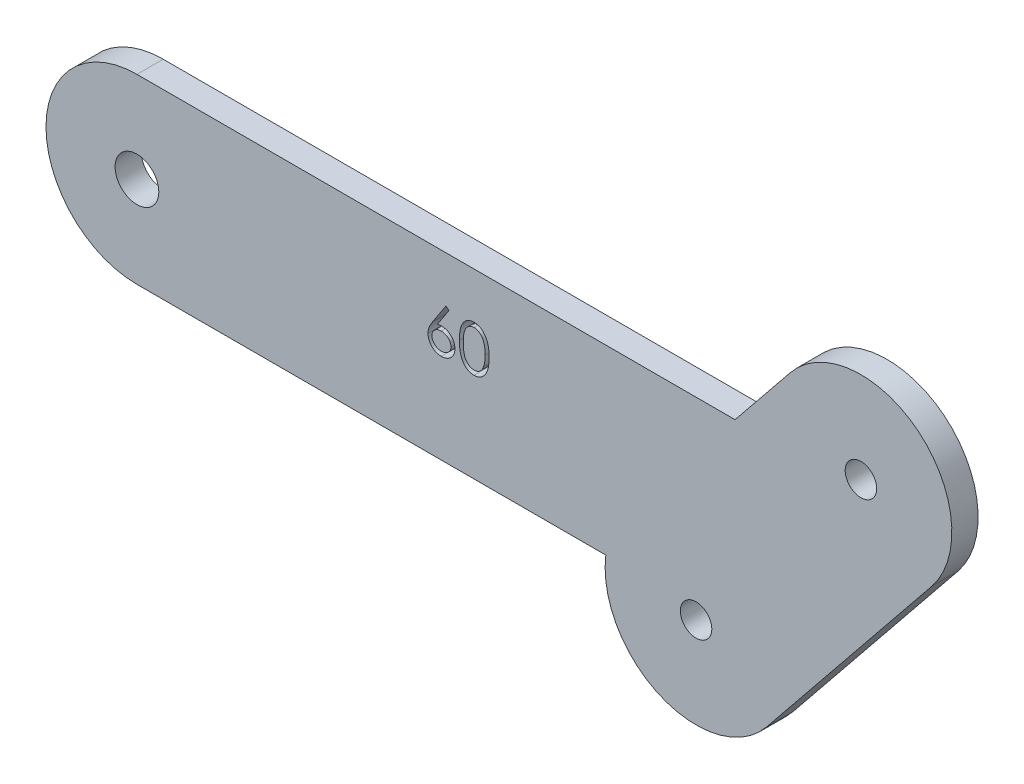
from build123d import *

# Parameters (mm, degrees)
SKETCH1_R            = 2.5
BOSS_EXTRUDE1_DEPTH  = 3
M3_CLEARANCE_HOLE1_D = 3.6
CUT_EXTRUDE1_DEPTH   = 2


with BuildPart() as part:
    # Sketch1 → Boss-Extrude1 (new body)
    with BuildSketch(Plane.XY):
        with BuildLine():
            ThreePointArc((53.62084913, -10.4), (59.884957147, -21.242518519), (72.032542278, -18.203533066))
            Line((72.032542278, -18.203533066), (90.887728901, 5.130603674))
            ThreePointArc((90.887728901, 5.130603674), (89.335026194, 19.756235773), (74.709394095, 18.203533066))
            Line((74.709394095, 18.203533066), (68.403736683, 10.4))
            Line((68.403736683, 10.4), (0, 10.4))
            ThreePointArc((0, 10.4), (-10.4, 0), (0, -10.4))
            Line((0, -10.4), (53.62084913, -10.4))
        make_face()
        Circle(SKETCH1_R, mode=Mode.SUBTRACT)
    extrude(amount=BOSS_EXTRUDE1_DEPTH)

    # M3 Clearance Hole1 (through all)
    with Locations(Plane.XY.offset(3)):
        with Locations((63.943374874, -11.66706837), (82.798561498, 11.66706837)):
            Hole(M3_CLEARANCE_HOLE1_D / 2)

    # Sketch5 → Cut-Extrude1 (cut)
    # profile 1 of 2: a face of its own
    with BuildSketch(Plane.XY.offset(3)):
        with BuildLine():
            Line((35.339330247, 5.128205128), (35.684883132, 4.856770833))
            Line((35.684883132, 4.856770833), (34.36376935, 2.836538462))
            add(Edge.make_bspline(
                [(34.36376935, 2.836538462), (34.451726888, 2.850558262), (34.623298012, 2.877905469), (34.796963581, 2.88241682), (34.881597875, 2.884615385)],
                knots=[0, 0, 0, 0, 1.025318673, 2, 2, 2, 2], degree=3))
            add(Edge.make_bspline(
                [(34.881597875, 2.884615385), (34.932415727, 2.883249511), (35.032449156, 2.880560829), (35.179316017, 2.859869613), (35.320443068, 2.827262311), (35.455245371, 2.779730517), (35.584206774, 2.719012867), (35.70806734, 2.646243053), (35.824498783, 2.557663509), (35.935000467, 2.458713573), (36.035324892, 2.34911788), (36.124147829, 2.232830257), (36.198757531, 2.109971855), (36.259291705, 1.980604904), (36.306298674, 1.844928819), (36.340566739, 1.703117191), (36.3608233, 1.555072232), (36.363574001, 1.454389124), (36.364971273, 1.403245192)],
                knots=[0, 0, 0, 0, 1.04369286, 2.054478336, 3.041073146, 4.015093852, 4.984733326, 5.965804835, 6.960378782, 7.985147595, 9.009457201, 10.008161701, 10.986880575, 11.956520048, 12.937015923, 13.931873656, 14.949455224, 16, 16, 16, 16], degree=3))
            add(Edge.make_bspline(
                [(36.364971273, 1.403245192), (36.362938266, 1.333274187), (36.358937789, 1.195587807), (36.319075223, 0.995049655), (36.257132874, 0.804003204), (36.168593547, 0.625498673), (36.058618714, 0.459780717), (35.924507868, 0.312944338), (35.77101717, 0.181987142), (35.597464601, 0.072477686), (35.410688938, -0.016955244), (35.214471799, -0.081191305), (35.010718733, -0.120739118), (34.872426436, -0.125697122), (34.802471273, -0.128205128)],
                knots=[0, 0, 0, 0, 1.031375318, 2.029502543, 3.004789286, 3.987476834, 4.960371455, 5.9300674, 6.912260825, 7.929083631, 8.949397511, 9.960523116, 10.96833055, 12, 12, 12, 12], degree=3))
            add(Edge.make_bspline(
                [(34.802471273, -0.128205128), (34.735190272, -0.126021977), (34.601918389, -0.121697537), (34.40587154, -0.083174769), (34.217495801, -0.02073605), (34.038110971, 0.065284347), (33.871938667, 0.173938466), (33.723273472, 0.304741722), (33.592856651, 0.454898101), (33.484321478, 0.624384311), (33.398237576, 0.806512822), (33.33368054, 0.996423045), (33.295971621, 1.193423019), (33.290702254, 1.326967503), (33.288048196, 1.394230769)],
                knots=[0, 0, 0, 0, 1.012016664, 2.004627821, 2.994792927, 3.992885782, 4.990978636, 5.973936114, 6.964471063, 7.975201453, 8.993600317, 9.990122807, 10.98767138, 12, 12, 12, 12], degree=3))
            add(Edge.make_bspline(
                [(33.288048196, 1.394230769), (33.289735974, 1.445723031), (33.293182096, 1.550860391), (33.317244082, 1.710094717), (33.355908074, 1.873024833), (33.399208426, 2.01124511), (33.444959298, 2.124475856), (33.483034354, 2.215766556), (33.530425777, 2.309710947), (33.580959179, 2.409530427), (33.639183277, 2.512652473), (33.702491348, 2.620800573), (33.772633706, 2.732254755), (33.821805367, 2.80788932), (33.846942426, 2.846554487)],
                knots=[0, 0, 0, 0, 1.173818275, 2.396712641, 3.66331629, 4.989737886, 5.693666774, 6.447286557, 7.243889047, 8.091586357, 8.998013824, 9.943181721, 10.948533338, 12, 12, 12, 12], degree=3))
            Line((33.846942426, 2.846554487), (35.339330247, 5.128205128))
        make_face()
        with BuildLine():
            add(Edge.make_bspline(
                [(34.787447234, 2.371794872), (34.749358313, 2.370683381), (34.674959585, 2.368512316), (34.565806136, 2.355904813), (34.462501491, 2.332163291), (34.363677014, 2.301925674), (34.271180296, 2.260349874), (34.184339096, 2.209847304), (34.102817593, 2.150388479), (34.027469662, 2.082815748), (33.959155857, 2.008832844), (33.900325671, 1.92959067), (33.849579385, 1.846998951), (33.808319643, 1.760367605), (33.776190964, 1.669729748), (33.752950605, 1.575502249), (33.740016675, 1.47705324), (33.737864916, 1.410292522), (33.736766144, 1.376201923)],
                knots=[0, 0, 0, 0, 1.129588631, 2.206414736, 3.251139165, 4.268635594, 5.265702196, 6.250456724, 7.242448911, 8.251968645, 9.246821453, 10.222880186, 11.173611482, 12.116736599, 13.062300278, 14.020270554, 14.989073742, 16, 16, 16, 16], degree=3))
            add(Edge.make_bspline(
                [(33.736766144, 1.376201923), (33.737660947, 1.342416238), (33.73941552, 1.276167538), (33.755347406, 1.178540139), (33.779683238, 1.084590269), (33.815883803, 0.994802271), (33.859065072, 0.907807531), (33.916072678, 0.826757123), (33.979239515, 0.746728452), (34.054745134, 0.673869207), (34.13577851, 0.606074029), (34.222351656, 0.546816524), (34.31258017, 0.496121991), (34.407682202, 0.456391851), (34.506308465, 0.423785727), (34.609280685, 0.400840757), (34.716670478, 0.387868577), (34.789416104, 0.385714015), (34.826509734, 0.384615385)],
                knots=[0, 0, 0, 0, 0.989467248, 1.94019797, 2.891935182, 3.827694429, 4.772920941, 5.730924762, 6.725747692, 7.756678648, 8.79901574, 9.819492441, 10.826891316, 11.826466727, 12.835195252, 13.867842842, 14.912794438, 16, 16, 16, 16], degree=3))
            add(Edge.make_bspline(
                [(34.826509734, 0.384615385), (34.863603303, 0.385714101), (34.93634881, 0.387868832), (35.043739467, 0.400839788), (35.146708494, 0.423789285), (35.245346364, 0.456378956), (35.340405551, 0.496169827), (35.430555153, 0.546501141), (35.516309572, 0.606438452), (35.597396143, 0.67375335), (35.672587484, 0.747143138), (35.737269311, 0.826042742), (35.792531072, 0.908462592), (35.837437054, 0.994459578), (35.873238899, 1.08464456), (35.897698137, 1.178525594), (35.913597122, 1.276171346), (35.915356216, 1.342417524), (35.916253324, 1.376201923)],
                knots=[0, 0, 0, 0, 1.087397944, 2.132534446, 3.165364764, 4.174271784, 5.174024072, 6.181601208, 7.194203697, 8.236725232, 9.267838612, 10.269026844, 11.221737037, 12.171628256, 13.107553087, 14.05945871, 15.010357665, 16, 16, 16, 16], degree=3))
            add(Edge.make_bspline(
                [(35.916253324, 1.376201923), (35.915467191, 1.410336996), (35.913924268, 1.477333042), (35.896472913, 1.575458211), (35.872269522, 1.670208506), (35.835722335, 1.760988433), (35.788241557, 1.847439758), (35.730408118, 1.929999187), (35.663504446, 2.009299684), (35.586222247, 2.082960838), (35.502093341, 2.150313807), (35.412642505, 2.209770316), (35.319059685, 2.259948854), (35.221439767, 2.301816143), (35.118664221, 2.332029678), (35.012392308, 2.355820025), (34.901264818, 2.36848005), (34.825869664, 2.370675858), (34.787447234, 2.371794872)],
                knots=[0, 0, 0, 0, 0.978206639, 1.919901502, 2.851605144, 3.780102724, 4.718870031, 5.675451981, 6.667674623, 7.690630536, 8.733308323, 9.756129687, 10.767539656, 11.776269907, 12.797430371, 13.836405707, 14.897401972, 16, 16, 16, 16], degree=3))
        make_face(mode=Mode.SUBTRACT)
    # profile 2 of 2: a face of its own
    with BuildSketch(Plane.XY.offset(3)):
        with BuildLine():
            add(Edge.make_bspline(
                [(36.877791785, 2.497996795), (36.878260383, 2.57813592), (36.87917064, 2.733807326), (36.889296956, 2.960642529), (36.906118873, 3.173442942), (36.929172263, 3.372218751), (36.95722652, 3.557021271), (36.994677216, 3.727356639), (37.037266934, 3.88401322), (37.08662757, 4.02750186), (37.142324412, 4.159755722), (37.202944784, 4.283220295), (37.270894491, 4.39770877), (37.342290081, 4.50504847), (37.420021611, 4.60348232), (37.501877026, 4.694400409), (37.591051135, 4.775701482), (37.684512576, 4.849767628), (37.783107525, 4.914695444), (37.884025619, 4.971885071), (37.987961485, 5.020742024), (38.095198889, 5.059156933), (38.204773972, 5.090886714), (38.317069781, 5.11258521), (38.43227173, 5.126237937), (38.510030922, 5.127543176), (38.549466465, 5.128205128)],
                knots=[0, 0, 0, 0, 1.646270934, 3.197905019, 4.663502075, 6.030701355, 7.308322542, 8.50163776, 9.611534131, 10.641858119, 11.616356847, 12.558055219, 13.465016945, 14.349605745, 15.204443733, 16.039544428, 16.859896111, 17.680448484, 18.487036065, 19.28249412, 20.06191084, 20.843045899, 21.620316918, 22.403196591, 23.190181807, 24, 24, 24, 24], degree=3))
            add(Edge.make_bspline(
                [(38.549466465, 5.128205128), (38.589231434, 5.127508249), (38.668311447, 5.126122377), (38.785226269, 5.112802459), (38.8994401, 5.090700854), (39.010466012, 5.059385176), (39.119215993, 5.02053421), (39.224839432, 4.971838328), (39.327992406, 4.915154232), (39.427035674, 4.848548693), (39.523056553, 4.774288298), (39.6136965, 4.690341629), (39.698963766, 4.597556315), (39.779928488, 4.496925081), (39.854293627, 4.386517817), (39.925112815, 4.268254803), (39.988501438, 4.140067853), (40.049550974, 4.004095757), (40.102246669, 3.856576244), (40.149769877, 3.698340872), (40.188168404, 3.527520605), (40.220153078, 3.345011683), (40.244931501, 3.15014385), (40.262978133, 2.943334828), (40.272511111, 2.724448555), (40.274306399, 2.574794485), (40.275227683, 2.497996795)],
                knots=[0, 0, 0, 0, 0.810914788, 1.612654377, 2.396697861, 3.181598691, 3.963628158, 4.749916497, 5.551656086, 6.361998678, 7.18212741, 8.025565596, 8.878627764, 9.750805457, 10.657531673, 11.591944965, 12.560506719, 13.57287815, 14.630710178, 15.753379473, 16.941251878, 18.199788006, 19.531962791, 20.947069417, 22.433333509, 24, 24, 24, 24], degree=3))
            add(Edge.make_bspline(
                [(40.275227683, 2.497996795), (40.274296848, 2.421534069), (40.272483154, 2.272549567), (40.263085001, 2.054648173), (40.244572671, 1.848936683), (40.221415545, 1.654921736), (40.18934274, 1.473410852), (40.149906789, 1.303775926), (40.106120613, 1.145284395), (40.052070907, 0.999234664), (39.99291275, 0.863589346), (39.928548184, 0.736921991), (39.859591289, 0.618113002), (39.784464511, 0.508113363), (39.704388206, 0.406143853), (39.617648508, 0.314004392), (39.526690529, 0.229474861), (39.430387078, 0.15425825), (39.329799148, 0.088422815), (39.227000466, 0.029545886), (39.120167062, -0.017929393), (39.011719986, -0.058693737), (38.900108035, -0.08983724), (38.785470334, -0.111371319), (38.668389997, -0.12647396), (38.589244904, -0.127626074), (38.549466465, -0.128205128)],
                knots=[0, 0, 0, 0, 1.561518951, 3.042555995, 4.452378317, 5.7783523, 7.031515105, 8.214008947, 9.334062868, 10.386615937, 11.391082383, 12.354592575, 13.286541444, 14.194233754, 15.072674879, 15.931287219, 16.775624067, 17.606195743, 18.42308326, 19.229000347, 20.022332153, 20.807536673, 21.593273796, 22.3848459, 23.188221202, 24, 24, 24, 24], degree=3))
            add(Edge.make_bspline(
                [(38.549466465, -0.128205128), (38.510032016, -0.127538906), (38.432274981, -0.126225246), (38.31705723, -0.112634201), (38.205225168, -0.090783482), (38.096226948, -0.060188334), (37.989503355, -0.022738567), (37.88650866, 0.026052409), (37.786097683, 0.082243936), (37.688538318, 0.146237395), (37.595663802, 0.219554086), (37.506951509, 0.300645927), (37.424630053, 0.391536514), (37.348009916, 0.49079069), (37.27518979, 0.597495322), (37.208204971, 0.713107283), (37.146246608, 0.837168155), (37.08961305, 0.970479456), (37.039400674, 1.114986496), (36.995046805, 1.272342466), (36.96002658, 1.443936231), (36.930050929, 1.628389613), (36.905873239, 1.826495228), (36.88936706, 2.038360625), (36.879165182, 2.263853781), (36.878257938, 2.418524887), (36.877791785, 2.497996795)],
                knots=[0, 0, 0, 0, 0.810891512, 1.598919785, 2.382837074, 3.152667961, 3.926044502, 4.706494248, 5.493654104, 6.291793342, 7.103789334, 7.925228297, 8.761435821, 9.622817696, 10.50288917, 11.416980706, 12.369136599, 13.353924996, 14.394355917, 15.514179734, 16.714354668, 17.994756427, 19.357759367, 20.818452758, 22.365282078, 24, 24, 24, 24], degree=3))
        make_face()
        with BuildLine():
            add(Edge.make_bspline(
                [(37.326509734, 2.5), (37.326680373, 2.433216145), (37.327011549, 2.303601795), (37.335663264, 2.115254279), (37.34744931, 1.939582381), (37.362651163, 1.776363043), (37.385226804, 1.626148739), (37.410522215, 1.487906335), (37.4413052, 1.362367425), (37.477726654, 1.248670552), (37.519211078, 1.144886169), (37.564505169, 1.048313004), (37.613163345, 0.957810238), (37.667619274, 0.874190798), (37.726926507, 0.797181992), (37.789745449, 0.725420803), (37.858420569, 0.661425115), (37.953425916, 0.584672465), (38.078849451, 0.505359417), (38.236878672, 0.436293574), (38.399262174, 0.392890065), (38.509478245, 0.387370414), (38.564490503, 0.384615385)],
                knots=[0, 0, 0, 0, 1.459021318, 2.831673884, 4.118529203, 5.306027144, 6.411944654, 7.436330062, 8.375795394, 9.233974572, 10.042671642, 10.816086306, 11.563610507, 12.285937304, 12.993564865, 13.685989202, 14.367179055, 15.041617293, 16.353048772, 17.594441528, 18.799311195, 20, 20, 20, 20], degree=3))
            add(Edge.make_bspline(
                [(38.564490503, 0.384615385), (38.619858606, 0.386897929), (38.730480496, 0.391458304), (38.892100203, 0.4354565), (39.049000589, 0.501841557), (39.171960504, 0.580337993), (39.265506995, 0.655092749), (39.332531266, 0.718827961), (39.394048478, 0.790193486), (39.452394299, 0.86719248), (39.505907265, 0.951296029), (39.55456889, 1.042099708), (39.598973672, 1.139855676), (39.624272309, 1.208098161), (39.63720685, 1.242988782)],
                knots=[0, 0, 0, 0, 1.353760809, 2.704726607, 4.075137775, 5.516104923, 6.260822281, 7.007110065, 7.778089737, 8.566572457, 9.372053459, 10.217411131, 11.088608312, 12, 12, 12, 12], degree=3))
            add(Edge.make_bspline(
                [(39.63720685, 1.242988782), (39.652280804, 1.287602696), (39.682887395, 1.378188073), (39.722332787, 1.518707576), (39.753397643, 1.666140096), (39.781345308, 1.819604548), (39.800421102, 1.980232693), (39.815775121, 2.147527527), (39.824818959, 2.321615187), (39.825940032, 2.439893746), (39.826509734, 2.5)],
                knots=[0, 0, 0, 0, 0.884706709, 1.796334032, 2.740027952, 3.714592787, 4.726048262, 5.777819803, 6.87074269, 8, 8, 8, 8], degree=3))
            add(Edge.make_bspline(
                [(39.826509734, 2.5), (39.82572375, 2.560096532), (39.824186196, 2.677658196), (39.81830907, 2.849827026), (39.803132535, 3.013352398), (39.786276651, 3.168938788), (39.761423478, 3.315724935), (39.734626611, 3.454939656), (39.698624879, 3.584858263), (39.660168058, 3.707514809), (39.616153207, 3.821515744), (39.567702158, 3.927392581), (39.515956789, 4.025656474), (39.459753588, 4.116037819), (39.399759755, 4.198941452), (39.334391828, 4.272705158), (39.266242724, 4.339615113), (39.170789601, 4.415990211), (39.04582633, 4.493864062), (38.890332548, 4.565529433), (38.728517342, 4.606684137), (38.619126693, 4.612486547), (38.564490503, 4.615384615)],
                knots=[0, 0, 0, 0, 1.31362396, 2.569729283, 3.763502607, 4.902122613, 5.988968491, 7.01645872, 7.998833611, 8.933434873, 9.825090667, 10.667526885, 11.477055099, 12.250526234, 12.991942729, 13.710640831, 14.402115721, 15.076753259, 16.378508321, 17.609869233, 18.806226677, 20, 20, 20, 20], degree=3))
            add(Edge.make_bspline(
                [(38.564490503, 4.615384615), (38.509189658, 4.612482549), (38.398487221, 4.606673129), (38.234990143, 4.565682766), (38.07826964, 4.494235672), (37.953636819, 4.415732283), (37.858117124, 4.340963267), (37.790856134, 4.276125475), (37.727790174, 4.205202255), (37.669693459, 4.127485233), (37.615280197, 4.04396328), (37.565307322, 3.95397933), (37.520282566, 3.857077381), (37.478733228, 3.753339617), (37.442200674, 3.639652553), (37.412066441, 3.514268277), (37.384227793, 3.376465574), (37.364520266, 3.225437706), (37.347000615, 3.062177486), (37.335741547, 2.886067032), (37.326982608, 2.697403631), (37.326670516, 2.567119119), (37.326509734, 2.5)],
                knots=[0, 0, 0, 0, 1.207732386, 2.417664972, 3.655092373, 4.956220595, 5.625982001, 6.301752483, 6.994047911, 7.697131622, 8.419323945, 9.170223765, 9.943494443, 10.752040957, 11.610060368, 12.549350801, 13.567764191, 14.679664412, 15.874934091, 17.154273443, 18.533957287, 20, 20, 20, 20], degree=3))
        make_face(mode=Mode.SUBTRACT)
    extrude(amount=-CUT_EXTRUDE1_DEPTH, mode=Mode.SUBTRACT)


solid = part.part
